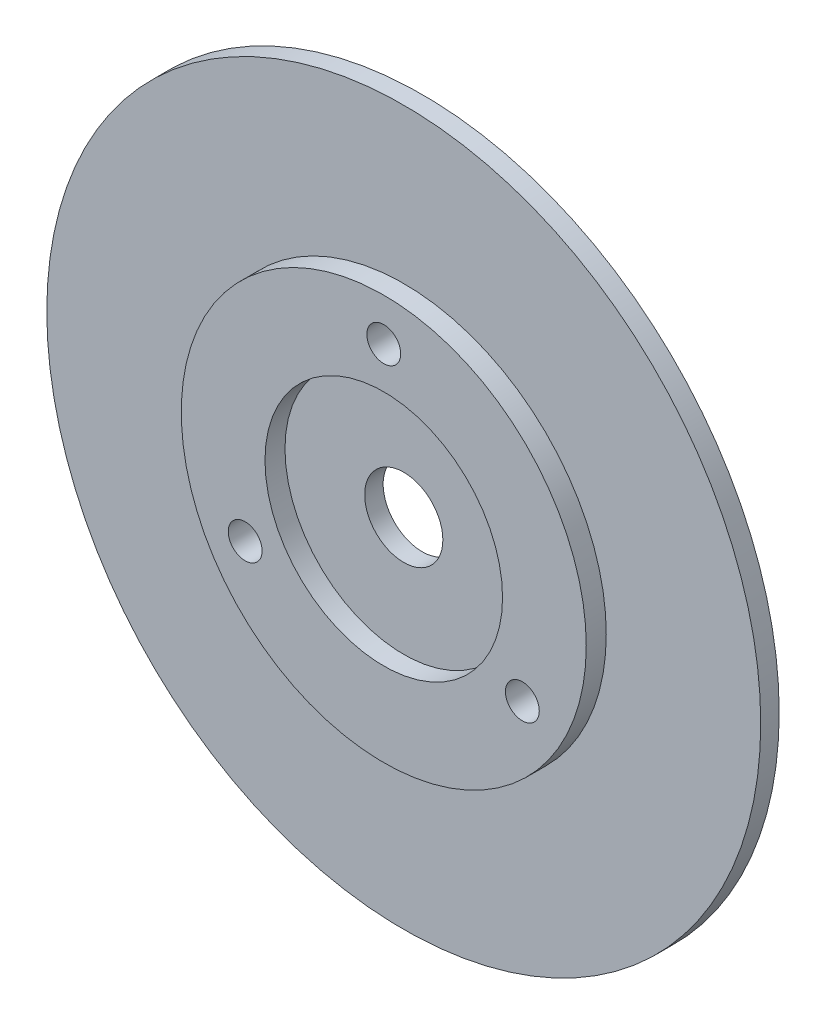
from build123d import *

# Parameters (mm, degrees)
M5_CLEARANCE_HOLE1_D = 5.5


with BuildPart() as part:
    # Sketch4 → Revolve1 (revolve)
    with BuildSketch(Plane(origin=(0, 0, 0), x_dir=(1, 0, 0), z_dir=(0, 1, 0))):
        Polygon((6.35, 0), (19.3, 0), (19.3, -3.25), (32.9, -3.25), (32.9, 0), (58, 0), (58, 3), (6.35, 3), align=None)
    revolve(axis=Axis((0, 0, 0), (0, 0, -1)))

    # M5 Clearance Hole1 (through all)
    with Locations(Plane.XY.offset(3.25)):
        with Locations((0, 26), (-22.516660498, -13), (22.516660498, -13)):
            Hole(M5_CLEARANCE_HOLE1_D / 2)


solid = part.part
